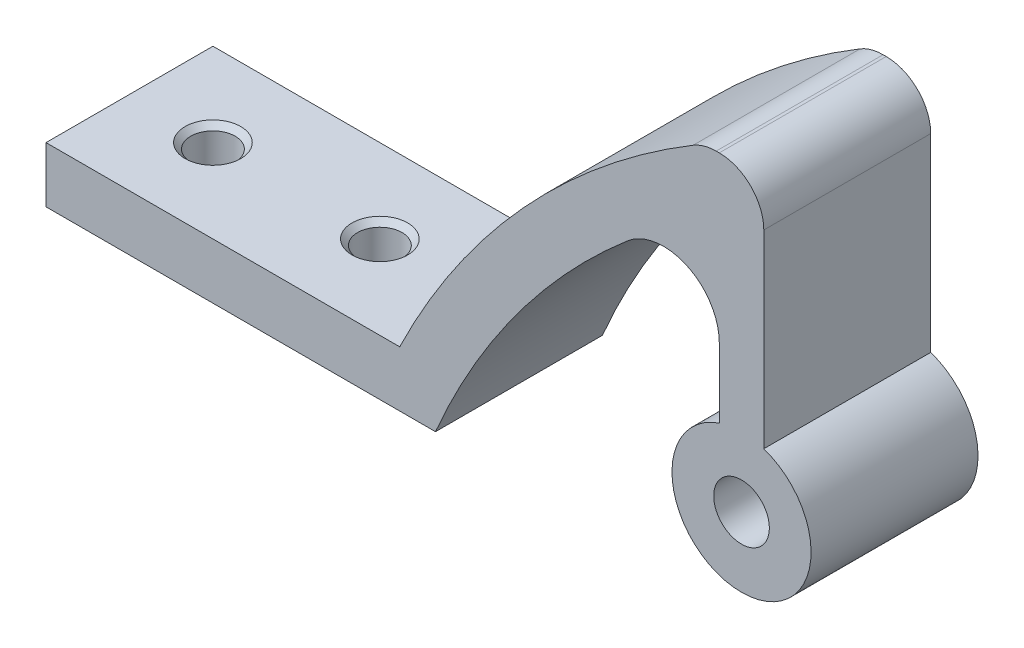
from build123d import *

# Parameters (mm, degrees)
SKETCH2_W           = 35
SKETCH2_H           = 15
SKETCH2_R           = 2
BOSS_EXTRUDE1_DEPTH = 5
BOSS_EXTRUDE6_DEPTH = 15
SKETCH8_R           = 6.25
BOSS_EXTRUDE7_DEPTH = 15
SKETCH10_R          = 2.5
CUT_EXTRUDE1_DEPTH  = 15
CHAMFER1_SIZE       = 0.5


with BuildPart() as part:
    # Sketch2 → Boss-Extrude1 (new body)
    with BuildSketch(Plane(origin=(0, 0, 0), x_dir=(1, 0, 0), z_dir=(0, 1, 0))):
        Rectangle(SKETCH2_W, SKETCH2_H)
        with Locations(Location((-10, 0, 0), (0, 0, 270))):
            Circle(SKETCH2_R, mode=Mode.SUBTRACT)
        with Locations(Location((5, 0, 0), (0, 0, 270))):
            Circle(SKETCH2_R, mode=Mode.SUBTRACT)
    extrude(amount=BOSS_EXTRUDE1_DEPTH)

    # Sketch6 → Boss-Extrude6 (add)
    with BuildSketch(Plane.XY.offset(7.5)):
        with BuildLine():
            Line((17.5, 0), (12.099846669, 0))
            ThreePointArc((12.099846669, 0), (23.57401107, 19.301397513), (40.656768617, 33.874653474))
            ThreePointArc((40.656768617, 33.874653474), (41.649703253, 34.30227285), (42.720886305, 34.44837004))
            Line((42.720886305, 34.44837004), (43, 34.44837004))
            ThreePointArc((43, 34.44837004), (45.828427125, 33.276797165), (47, 30.44837004))
            Line((47, 30.44837004), (47, 7.5))
            Line((47, 7.5), (43, 7.5))
            Line((43, 7.5), (43, 19.677123519))
            ThreePointArc((43, 19.677123519), (40.094264769, 24.217393894), (34.754377969, 23.480534834))
            ThreePointArc((34.754377969, 23.480534834), (24.767284072, 12.739576569), (17.5, 0))
        make_face()
    extrude(amount=-BOSS_EXTRUDE6_DEPTH)

    # Sketch8 → Boss-Extrude7 (add)
    with BuildSketch(Plane.XY.offset(7.5)):
        with Locations((45, 7.5)):
            Circle(SKETCH8_R)
    extrude(amount=-BOSS_EXTRUDE7_DEPTH)

    # Sketch10 → Cut-Extrude1 (cut)
    with BuildSketch(Plane.XY.offset(7.5)):
        with Locations((45, 7.5)):
            Circle(SKETCH10_R)
    extrude(amount=-CUT_EXTRUDE1_DEPTH, mode=Mode.SUBTRACT)

    # Chamfer1
    chamfer1_edges = [part.edges().sort_by_distance(p)[0] for p in [
        (-10, 5, -2),
        (5, 5, -2),
    ]]
    chamfer(chamfer1_edges, length=CHAMFER1_SIZE)


solid = part.part
